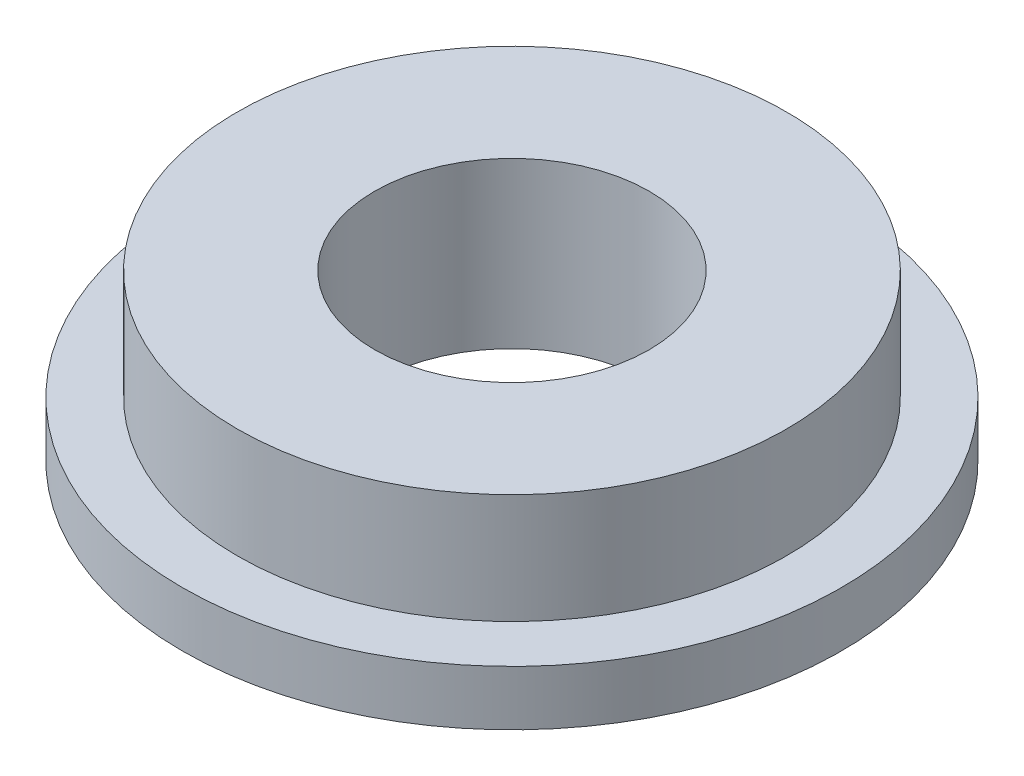
from build123d import *

# Parameters (mm, degrees)
SKETCH_1_R      = 3.6
SKETCH_1_R_2    = 3
EXTRUDE_1_DEPTH = 0.6
SKETCH_1_3_R    = 3
SKETCH_1_3_R_2  = 1.5
EXTRUDE_2_DEPTH = 1.8


with BuildPart() as part:
    # 草图1 → 凸台-拉伸1 (new body)
    with BuildSketch(Plane(origin=(0, 0, 0), x_dir=(1, 0, 0), z_dir=(0, 1, 0))):
        Circle(SKETCH_1_R)
        Circle(SKETCH_1_R_2, mode=Mode.SUBTRACT)
    extrude(amount=EXTRUDE_1_DEPTH)

    # 草图1<3> → 凸台-拉伸2 (add)
    with BuildSketch(Plane(origin=(0, 0, 0), x_dir=(1, 0, 0), z_dir=(0, 1, 0))):
        Circle(SKETCH_1_3_R)
        Circle(SKETCH_1_3_R_2, mode=Mode.SUBTRACT)
    extrude(amount=EXTRUDE_2_DEPTH)


solid = part.part
